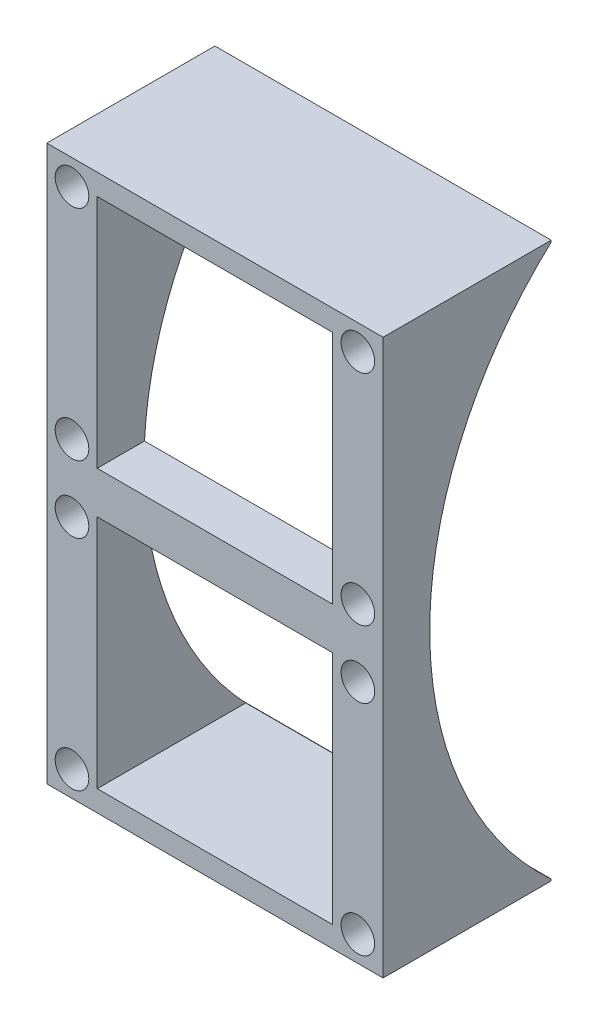
from build123d import *

# Parameters (mm, degrees)
SKETCH1_W               = 40
SKETCH1_H               = 66
SKETCH1_W_2             = 28
SKETCH1_H_2             = 28
BOSS_EXTRUDE1_DEPTH     = 20
CUT_EXTRUDE1_DEPTH      = 26
CUT_EXTRUDE1_DEPTH_BACK = 27
SKETCH3_R               = 44.45
SKETCH4_R               = 2
CUT_EXTRUDE2_DEPTH      = 27
SKETCH5_R               = 2
CUT_EXTRUDE3_DEPTH      = 44.462627716


with BuildPart() as part:
    # Sketch1 → Boss-Extrude1 (new body)
    with BuildSketch(Plane.XY):
        Rectangle(SKETCH1_W, SKETCH1_H)
        with Locations((0, 16.5)):
            Rectangle(SKETCH1_W_2, SKETCH1_H_2, mode=Mode.SUBTRACT)
        with Locations((0, -16.5)):
            Rectangle(SKETCH1_W_2, SKETCH1_H_2, mode=Mode.SUBTRACT)
    extrude(amount=BOSS_EXTRUDE1_DEPTH)

    # Sketch3 → Cut-Extrude1 (cut, two sides: drawn at the far end of the back side and taken through both)
    with BuildSketch(Plane(origin=(0, 0, 0), x_dir=(0, 0, -1), z_dir=(1, 0, 0)).offset(-CUT_EXTRUDE1_DEPTH_BACK)):
        with Locations((30, 0)):
            Circle(SKETCH3_R)
    extrude(amount=CUT_EXTRUDE1_DEPTH + CUT_EXTRUDE1_DEPTH_BACK, mode=Mode.SUBTRACT)

    # Sketch4 → Cut-Extrude2 (cut)
    with BuildSketch(Plane.XY.offset(20)):
        with Locations((-17, 30)):
            Circle(SKETCH4_R)
        with Locations((17, 30)):
            Circle(SKETCH4_R)
        with Locations((-17, -30)):
            Circle(SKETCH4_R)
        with Locations((17, -30)):
            Circle(SKETCH4_R)
    extrude(amount=-CUT_EXTRUDE2_DEPTH, mode=Mode.SUBTRACT)

    # Sketch5 → Cut-Extrude3 (cut, through all)
    with BuildSketch(Plane.XY.offset(20)):
        with Locations((-17, 4)):
            Circle(SKETCH5_R)
        with Locations((-17, -4)):
            Circle(SKETCH5_R)
        with Locations((17, 4)):
            Circle(SKETCH5_R)
        with Locations((17, -4)):
            Circle(SKETCH5_R)
    extrude(amount=-CUT_EXTRUDE3_DEPTH, mode=Mode.SUBTRACT)


solid = part.part
